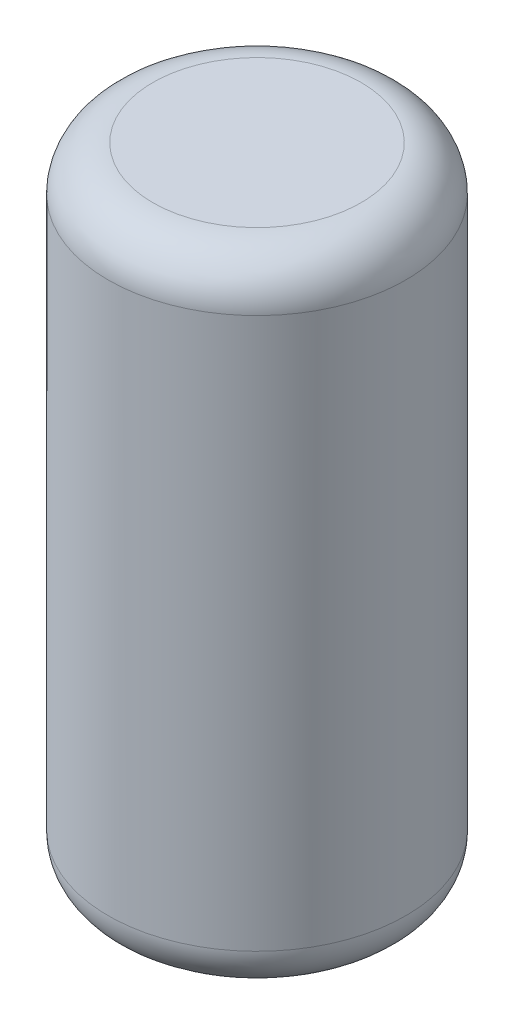
from build123d import *

# Parameters (mm, degrees)
SKETCH_1_W = 50
SKETCH_1_H = 215
FILLET_1_R = 15


with BuildPart() as part:
    # Эскиз1 → Повернуть1 (revolve)
    with BuildSketch(Plane.XY, mode=Mode.PRIVATE) as revolve_1_sk:
        with Locations((25, 107.5)):
            Rectangle(SKETCH_1_W, SKETCH_1_H)
    revolve(revolve_1_sk.sketch.rotate(Axis((0, 0, 0), (0, 1, 0)), 90), axis=Axis((0, 0, 0), (0, 1, 0)))

    # Скругление1
    fillet_1_edges = [part.edges().sort_by_distance(p)[0] for p in [
        (0, 0, 50),
        (0, 215, 50),
    ]]
    fillet(fillet_1_edges, radius=FILLET_1_R)


solid = part.part
